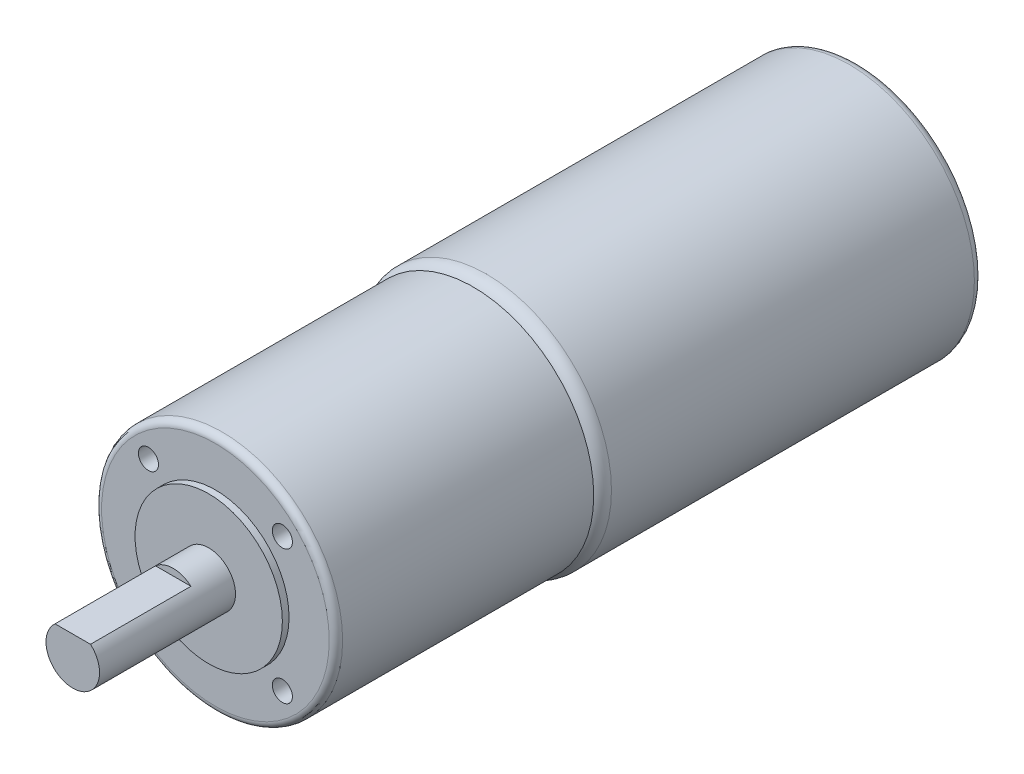
from build123d import *

# Parameters (mm, degrees)
SKETCH1_R           = 18
SKETCH1_R_2         = 1.5
GEARBOX_DEPTH       = 38.5
SKETCH3_R           = 4
BOSS_EXTRUDE2_DEPTH = 21.3
SKETCH4_W           = 5.291502622
SKETCH4_H           = 1
CUT_EXTRUDE1_DEPTH  = 15
FILLET1_R           = 1
SKETCH5_R           = 11
BOSS_EXTRUDE3_DEPTH = 1


with BuildPart() as part:
    # Sketch1 → GearBox (new body)
    with BuildSketch(Plane.XY):
        Circle(SKETCH1_R)
        with Locations((-10, 10)):
            Circle(SKETCH1_R_2, mode=Mode.SUBTRACT)
        with Locations((10, 10)):
            Circle(SKETCH1_R_2, mode=Mode.SUBTRACT)
        with Locations((10, -10)):
            Circle(SKETCH1_R_2, mode=Mode.SUBTRACT)
        with Locations((-10, -10)):
            Circle(SKETCH1_R_2, mode=Mode.SUBTRACT)
    extrude(amount=GEARBOX_DEPTH)

    # Sketch2 → Motor (revolve)
    with BuildSketch(Plane(origin=(0, 0, 0), x_dir=(0, 0, -1), z_dir=(1, 0, 0)), mode=Mode.PRIVATE) as motor_sk:
        with BuildLine():
            Line((0, 0), (57.5, 0))
            Line((57.5, 0), (57.5, 17.35))
            ThreePointArc((57.5, 17.35), (57.119238816, 18.269238816), (56.2, 18.65))
            Line((56.2, 18.65), (2, 18.65))
            ThreePointArc((2, 18.65), (0.585786438, 18.064213562), (0, 16.65))
            Line((0, 16.65), (0, 0))
        make_face()
    revolve(motor_sk.sketch.rotate(Axis((0, 0, 1000), (0, 0, -1)), 90), axis=Axis((0, 0, 1000), (0, 0, -1)))

    # Sketch3 → Boss-Extrude2 (add)
    with BuildSketch(Plane.XY.offset(38.5)):
        Circle(SKETCH3_R)
    extrude(amount=BOSS_EXTRUDE2_DEPTH)

    # Sketch4 → Cut-Extrude1 (cut)
    with BuildSketch(Plane.XY.offset(59.8)):
        with Locations((0, 3.5)):
            Rectangle(SKETCH4_W, SKETCH4_H)
    extrude(amount=-CUT_EXTRUDE1_DEPTH, mode=Mode.SUBTRACT)

    # Fillet1
    fillet1_edges = [part.edges().sort_by_distance(p)[0] for p in [
        (-18, 0, 38.5),
    ]]
    fillet(fillet1_edges, radius=FILLET1_R)

    # Sketch5 → Boss-Extrude3 (add)
    with BuildSketch(Plane.XY.offset(38.5)):
        Circle(SKETCH5_R)
    extrude(amount=BOSS_EXTRUDE3_DEPTH)


solid = part.part
